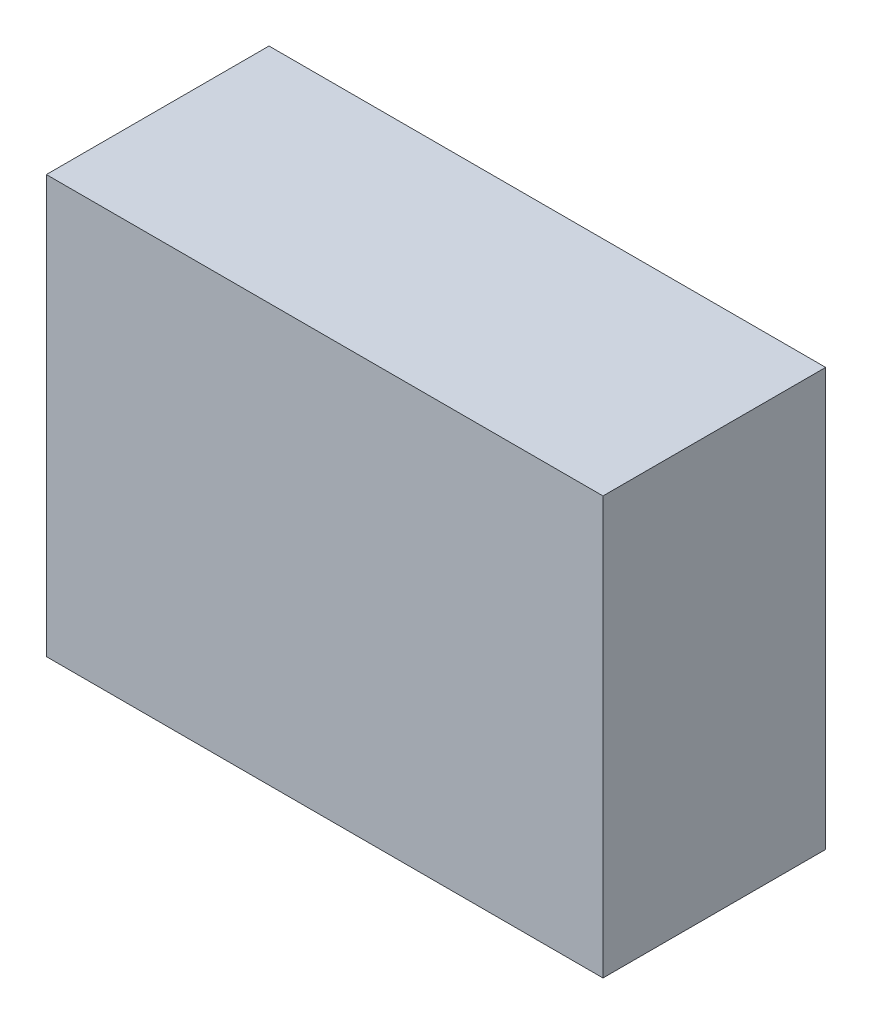
from build123d import *

# Parameters (mm, degrees)
SKETCH_1_W      = 800
SKETCH_1_H      = 600
EXTRUDE_1_DEPTH = 320


with BuildPart() as part:
    # Эскиз1 → Бобышка-Вытянуть1 (new body)
    with BuildSketch(Plane.XY):
        Rectangle(SKETCH_1_W, SKETCH_1_H)
    extrude(amount=EXTRUDE_1_DEPTH)


solid = part.part
